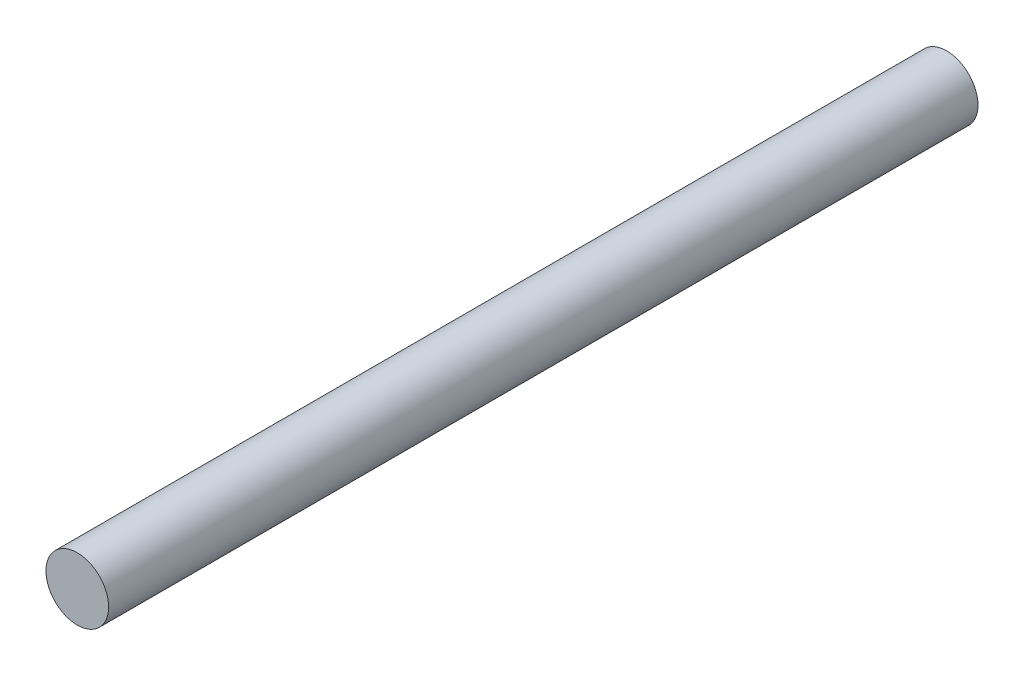
from build123d import *

# Parameters (mm, degrees)
SKETCH1_R           = 4.7625
BOSS_EXTRUDE1_DEPTH = 132.08


with BuildPart() as part:
    # Sketch1 → Boss-Extrude1 (new body)
    with BuildSketch(Plane.XY):
        Circle(SKETCH1_R)
    extrude(amount=BOSS_EXTRUDE1_DEPTH)


solid = part.part
